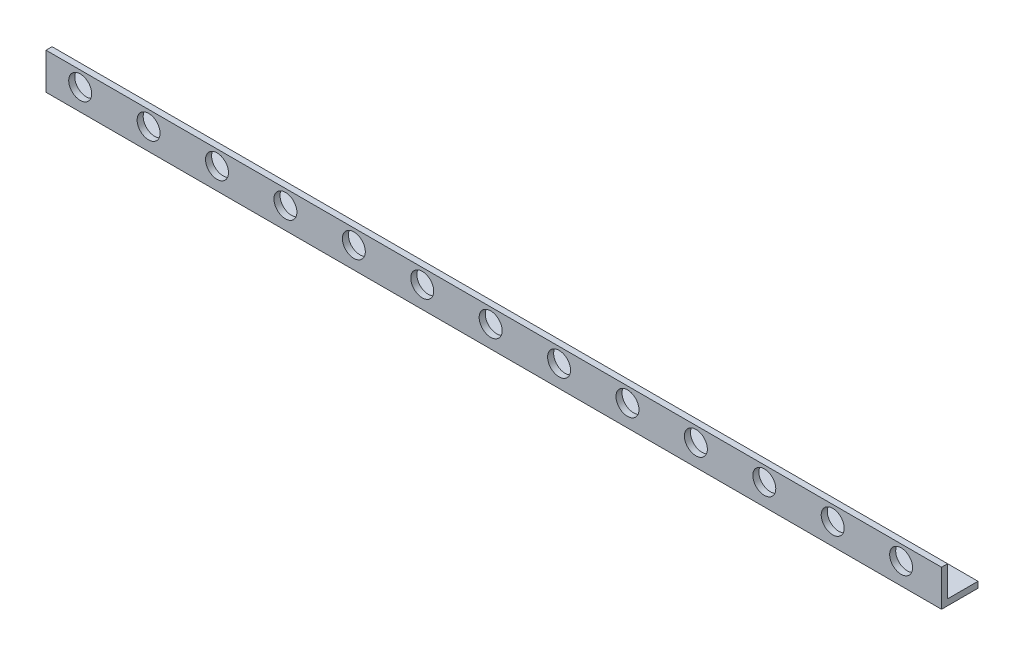
from build123d import *

# Parameters (mm, degrees)
BOSS_EXTRUDE1_DEPTH = 468
SKETCH2_R           = 6
CUT_EXTRUDE1_DEPTH  = 3.175


with BuildPart() as part:
    # Sketch1 → Boss-Extrude1 (new body)
    with BuildSketch(Plane(origin=(0, 0, 0), x_dir=(0, 0, -1), z_dir=(1, 0, 0))):
        Polygon((0, 0), (0, 19.05), (3.175, 19.05), (3.175, 3.175), (19.05, 3.175), (19.05, 0), align=None)
    extrude(amount=-BOSS_EXTRUDE1_DEPTH)

    # Sketch2 → Cut-Extrude1 (cut)
    with BuildSketch(Plane.XY):
        with Locations((-450.13, 11.273546723)):
            Circle(SKETCH2_R)
        with Locations((-414.38, 11.273546723)):
            Circle(SKETCH2_R)
        with Locations((-378.63, 11.273546723)):
            Circle(SKETCH2_R)
        with Locations((-342.88, 11.273546723)):
            Circle(SKETCH2_R)
        with Locations((-307.13, 11.273546723)):
            Circle(SKETCH2_R)
        with Locations((-271.38, 11.273546723)):
            Circle(SKETCH2_R)
        with Locations((-235.63, 11.273546723)):
            Circle(SKETCH2_R)
        with Locations((-199.88, 11.273546723)):
            Circle(SKETCH2_R)
        with Locations((-164.13, 11.273546723)):
            Circle(SKETCH2_R)
        with Locations((-128.38, 11.273546723)):
            Circle(SKETCH2_R)
        with Locations((-92.63, 11.273546723)):
            Circle(SKETCH2_R)
        with Locations((-56.88, 11.273546723)):
            Circle(SKETCH2_R)
        with Locations((-21.13, 11.273546723)):
            Circle(SKETCH2_R)
    extrude(amount=-CUT_EXTRUDE1_DEPTH, mode=Mode.SUBTRACT)


solid = part.part
